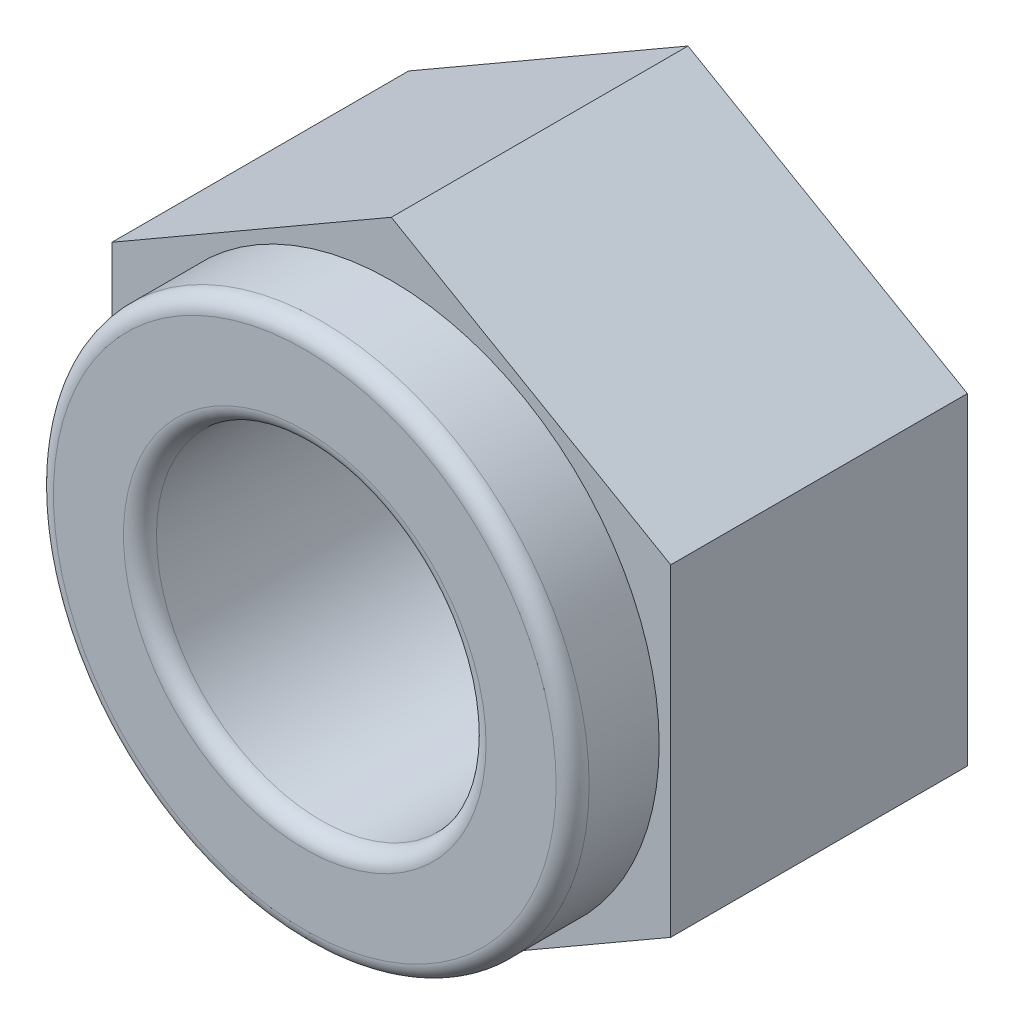
from build123d import *

# Parameters (mm, degrees)
EXTRUDE_1_DEPTH     = 3.6
SKETCH_2_R          = 3.25
SKETCH_2_R_2        = 2
EXTRUDE_2_DEPTH     = 1.05
SKETCH_3_R          = 2
CUT_EXTRUDE_1_DEPTH = 7.306734496
FILLET_1_R          = 0.2
FILLET_2_R          = 0.2


with BuildPart() as part:
    # 草图1 → 凸台-拉伸1 (new body)
    with BuildSketch(Plane.XY):
        Polygon((-3.39, -1.957217413), (0, -3.914434825), (3.39, -1.957217413), (3.39, 1.957217413), (0, 3.914434825), (-3.39, 1.957217413), align=None)
    extrude(amount=EXTRUDE_1_DEPTH)

    # 草图2 → 凸台-拉伸2 (add)
    with BuildSketch(Plane.XY.offset(3.6)):
        Circle(SKETCH_2_R)
        Circle(SKETCH_2_R_2, mode=Mode.SUBTRACT)
    extrude(amount=EXTRUDE_2_DEPTH)

    # 草图3 → 切除-拉伸1 (cut, through all)
    with BuildSketch(Plane.XY.offset(3.6)):
        Circle(SKETCH_3_R)
    extrude(amount=-CUT_EXTRUDE_1_DEPTH, mode=Mode.SUBTRACT)

    # 圆角1
    fillet_1_edges = [part.edges().sort_by_distance(p)[0] for p in [
        (-2, 0, 4.65),
    ]]
    fillet(fillet_1_edges, radius=FILLET_1_R)

    # 圆角2
    fillet_2_edges = [part.edges().sort_by_distance(p)[0] for p in [
        (-3.25, 0, 4.65),
    ]]
    fillet(fillet_2_edges, radius=FILLET_2_R)


solid = part.part
